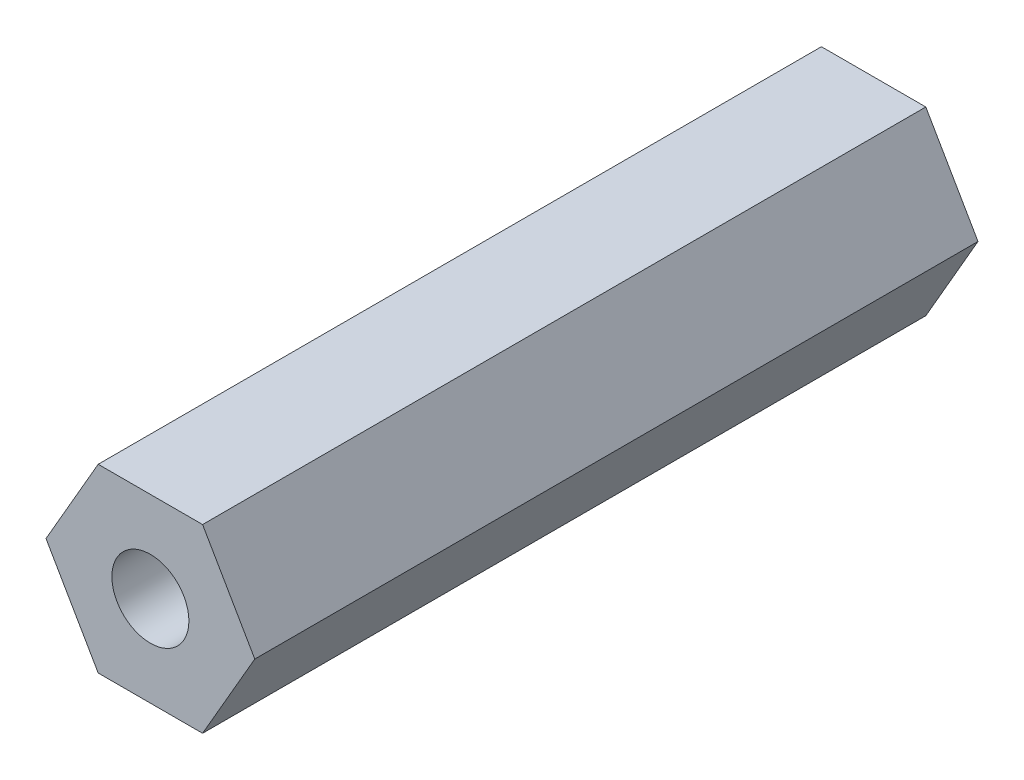
from build123d import *

# Parameters (mm, degrees)
BOSS_EXTRUDE1_DEPTH         = 25.4
F_1_4_28_TAPPED_HOLE1_D     = 5.4102
F_1_4_28_TAPPED_HOLE1_DEPTH = 22.225
F_1_4_28_TAPPED_HOLE1_TIP   = 1.625388061
F_1_4_28_TAPPED_HOLE2_D     = 5.4102
F_1_4_28_TAPPED_HOLE2_DEPTH = 22.225
F_1_4_28_TAPPED_HOLE2_TIP   = 1.625388061


with BuildPart() as part:
    # Sketch1 → Boss-Extrude1 (new, symmetric)
    with BuildSketch(Plane.XY):
        Polygon((7.332348419, 0), (3.666174209, 6.35), (-3.666174209, 6.35), (-7.332348419, 0), (-3.666174209, -6.35), (3.666174209, -6.35), align=None)
    extrude(amount=BOSS_EXTRUDE1_DEPTH, both=True)

    # 1/4-28 Tapped Hole1
    with Locations(Plane.XY.offset(25.4)):
        with Locations((0, 0)):
            Hole(F_1_4_28_TAPPED_HOLE1_D / 2, depth=F_1_4_28_TAPPED_HOLE1_DEPTH)
            with Locations((0, 0, -(F_1_4_28_TAPPED_HOLE1_DEPTH + F_1_4_28_TAPPED_HOLE1_TIP / 2))):  # 118° drill point
                Cone(0, F_1_4_28_TAPPED_HOLE1_D / 2, F_1_4_28_TAPPED_HOLE1_TIP, mode=Mode.SUBTRACT)

    # 1/4-28 Tapped Hole2
    with Locations(Plane(origin=(0, 0, -25.4), x_dir=(-1, 0, 0), z_dir=(0, 0, -1))):
        with Locations((0, 0)):
            Hole(F_1_4_28_TAPPED_HOLE2_D / 2, depth=F_1_4_28_TAPPED_HOLE2_DEPTH)
            with Locations((0, 0, -(F_1_4_28_TAPPED_HOLE2_DEPTH + F_1_4_28_TAPPED_HOLE2_TIP / 2))):  # 118° drill point
                Cone(0, F_1_4_28_TAPPED_HOLE2_D / 2, F_1_4_28_TAPPED_HOLE2_TIP, mode=Mode.SUBTRACT)


solid = part.part
